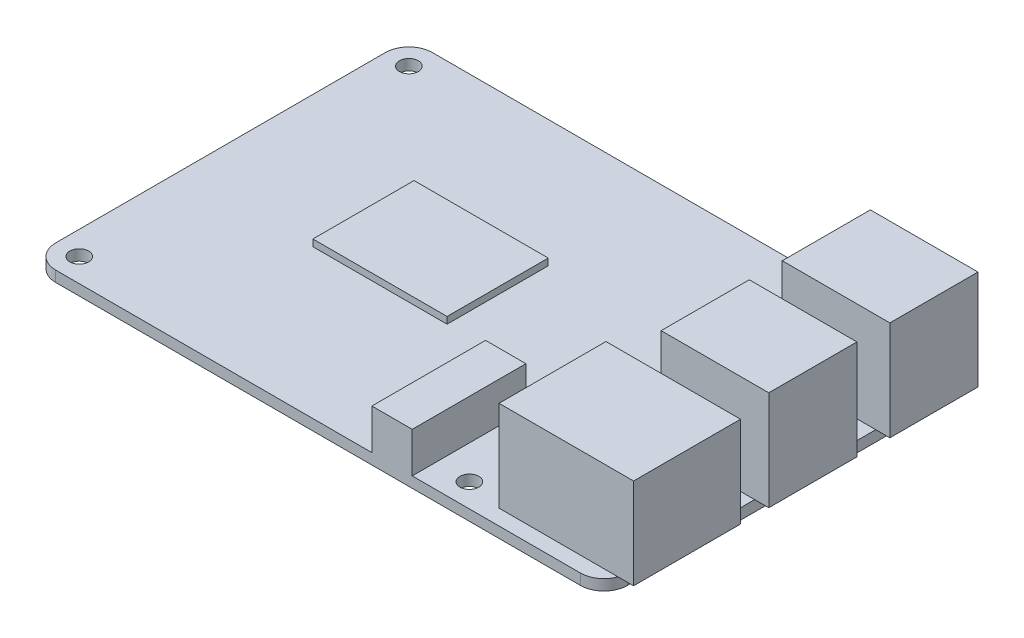
from build123d import *

# Parameters (mm, degrees)
SKETCH1_R           = 1.4
BOSS_EXTRUDE1_DEPTH = 1.6
SKETCH2_W           = 20
SKETCH2_H           = 15.9
BOSS_EXTRUDE2_DEPTH = 13.5
SKETCH3_W           = 16
SKETCH3_H           = 13.1
BOSS_EXTRUDE3_DEPTH = 14.8
SKETCH4_W           = 6
SKETCH4_H           = 16.9
BOSS_EXTRUDE4_DEPTH = 6
SKETCH6_W           = 19.946979578
SKETCH6_H           = 15.036953836
BOSS_EXTRUDE5_DEPTH = 1


with BuildPart() as part:
    # Sketch1 → Boss-Extrude1 (new body)
    with BuildSketch(Plane(origin=(0, 0, 0), x_dir=(1, 0, 0), z_dir=(0, 1, 0))):
        with BuildLine():
            Line((-39, 28), (39, 28))
            ThreePointArc((39, 28), (41.474873734, 26.974873734), (42.5, 24.5))
            Line((42.5, 24.5), (42.5, -24.5))
            ThreePointArc((42.5, -24.5), (41.474873734, -26.974873734), (39, -28))
            Line((39, -28), (-39, -28))
            ThreePointArc((-39, -28), (-41.474873734, -26.974873734), (-42.5, -24.5))
            Line((-42.5, -24.5), (-42.5, 24.5))
            ThreePointArc((-42.5, 24.5), (-41.474873734, 26.974873734), (-39, 28))
        make_face()
        with Locations(Location((-39, 24.5, 0), (0, 0, 270))):
            Circle(SKETCH1_R, mode=Mode.SUBTRACT)
        with Locations(Location((19, 24.5, 0), (0, 0, 270))):
            Circle(SKETCH1_R, mode=Mode.SUBTRACT)
        with Locations(Location((19, -24.5, 0), (0, 0, 90))):
            Circle(SKETCH1_R, mode=Mode.SUBTRACT)
        with Locations(Location((-39, -24.5, 0), (0, 0, 90))):
            Circle(SKETCH1_R, mode=Mode.SUBTRACT)
    extrude(amount=BOSS_EXTRUDE1_DEPTH)

    # Sketch2 → Boss-Extrude2 (add)
    with BuildSketch(Plane(origin=(0, 1.6, 0), x_dir=(1, 0, 0), z_dir=(0, 1, 0))):
        with Locations((34.6, -17.75)):
            Rectangle(SKETCH2_W, SKETCH2_H)
    extrude(amount=BOSS_EXTRUDE2_DEPTH)

    # Sketch3 → Boss-Extrude3 (add)
    with BuildSketch(Plane(origin=(0, 1.6, 0), x_dir=(1, 0, 0), z_dir=(0, 1, 0))):
        with Locations((36.6, 0.95)):
            Rectangle(SKETCH3_W, SKETCH3_H)
        with Locations((36.6, 18.95)):
            Rectangle(SKETCH3_W, SKETCH3_H)
    extrude(amount=BOSS_EXTRUDE3_DEPTH)

    # Sketch4 → Boss-Extrude4 (add)
    with BuildSketch(Plane(origin=(0, 1.6, 0), x_dir=(1, 0, 0), z_dir=(0, 1, 0))):
        with Locations((11, -19.55)):
            Rectangle(SKETCH4_W, SKETCH4_H)
    extrude(amount=BOSS_EXTRUDE4_DEPTH)

    # Sketch6 → Boss-Extrude5 (add)
    with BuildSketch(Plane(origin=(0, 1.6, 0), x_dir=(1, 0, 0), z_dir=(0, 1, 0))):
        with Locations((-12.912885705, 1.636675247)):
            Rectangle(SKETCH6_W, SKETCH6_H)
    extrude(amount=BOSS_EXTRUDE5_DEPTH)


solid = part.part
